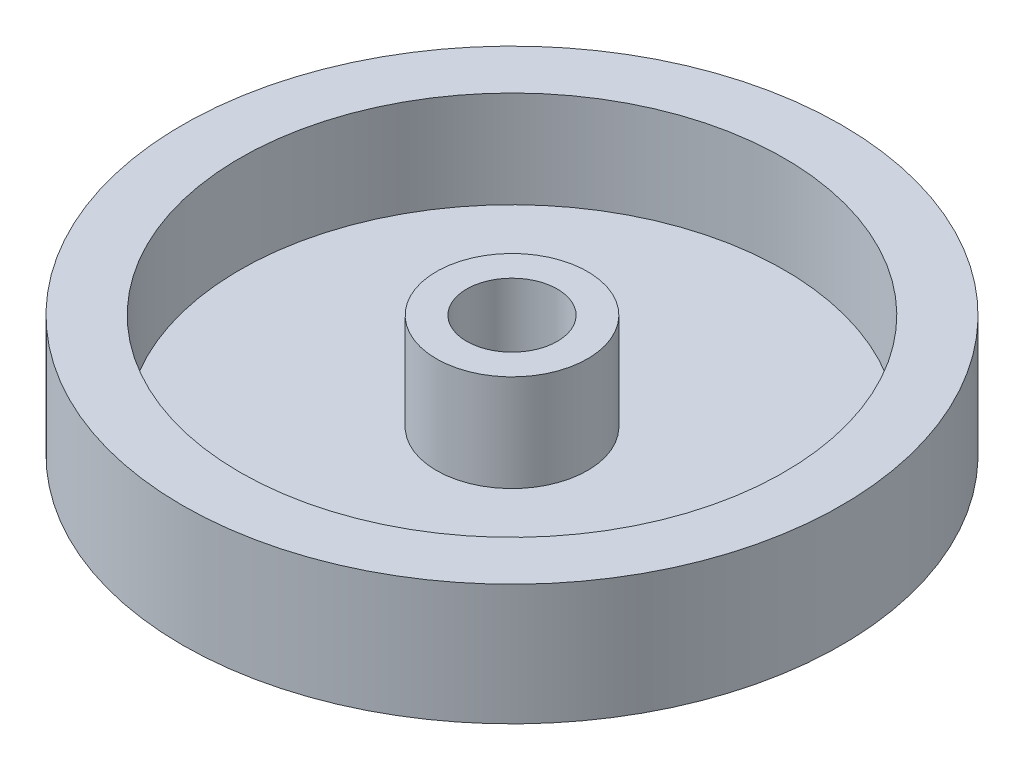
from build123d import *

# Parameters (mm, degrees)
SKETCH_1_R          = 10.9
EXTRUDE_1_DEPTH     = 4
SKETCH_2_R          = 9
SKETCH_2_R_2        = 2.5
CUT_EXTRUDE_2_DEPTH = 3.2
SKETCH_3_R          = 1.5
CUT_EXTRUDE_3_DEPTH = 16.925451328


with BuildPart() as part:
    # Эскиз1 → Вытянуть1 (new body)
    with BuildSketch(Plane(origin=(0, 0, 0), x_dir=(1, 0, 0), z_dir=(0, 1, 0))):
        with Locations(Location((0, 0, 0), (0, 0, 270))):
            Circle(SKETCH_1_R)
    extrude(amount=EXTRUDE_1_DEPTH)

    # Эскиз2 → Вытянуть2 (cut)
    with BuildSketch(Plane(origin=(0, 4, 0), x_dir=(1, 0, 0), z_dir=(0, 1, 0))):
        with Locations(Location((0, 0, 0), (0, 0, 270))):
            Circle(SKETCH_2_R)
        with Locations(Location((0, 0, 0), (0, 0, 270))):
            Circle(SKETCH_2_R_2, mode=Mode.SUBTRACT)
    extrude(amount=-CUT_EXTRUDE_2_DEPTH, mode=Mode.SUBTRACT)

    # Эскиз3 → Вытянуть3 (cut, through all)
    with BuildSketch(Plane(origin=(0, 4, 0), x_dir=(1, 0, 0), z_dir=(0, 1, 0))):
        with Locations(Location((0, 0, 0), (0, 0, 270))):
            Circle(SKETCH_3_R)
    extrude(amount=-CUT_EXTRUDE_3_DEPTH, mode=Mode.SUBTRACT)


solid = part.part
